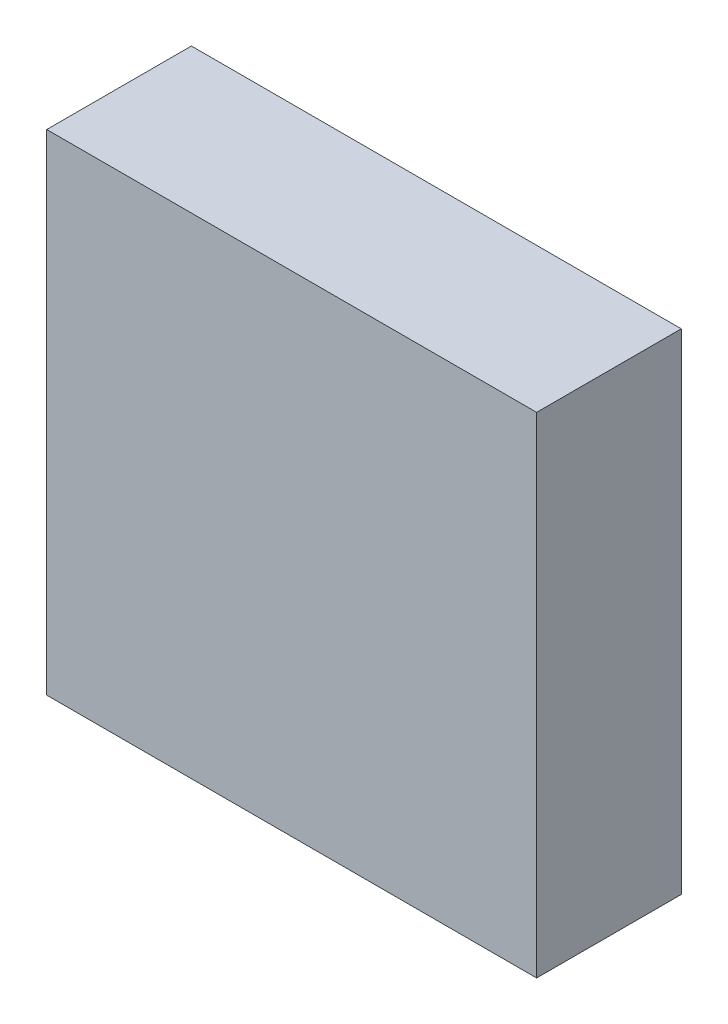
from build123d import *

# Parameters (mm, degrees)
SKETCH1_W           = 508
SKETCH1_H           = 508
BOSS_EXTRUDE1_DEPTH = 150


with BuildPart() as part:
    # Sketch1 → Boss-Extrude1 (new body)
    with BuildSketch(Plane.XY):
        with Locations((29.657944651, 18.505886441)):
            Rectangle(SKETCH1_W, SKETCH1_H)
    extrude(amount=BOSS_EXTRUDE1_DEPTH)


solid = part.part
